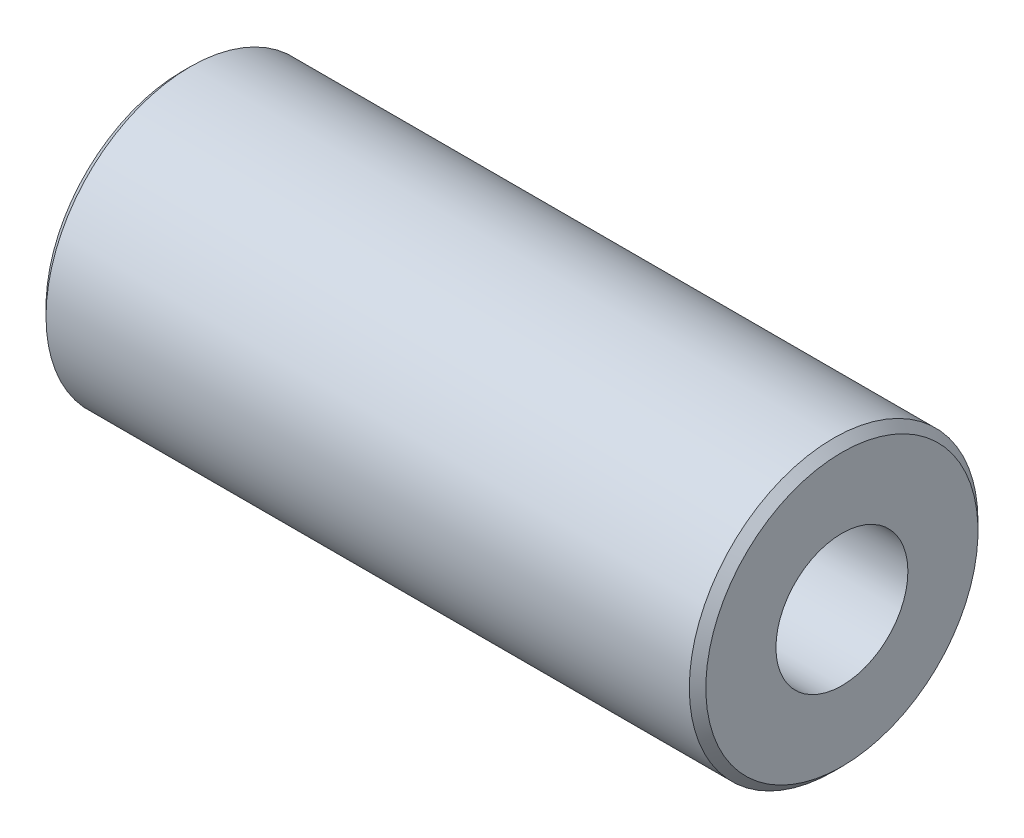
from build123d import *

# Parameters (mm, degrees)
SKETCH_1_W     = 8
SKETCH_1_H     = 1.75
CHAMFER_1_SIZE = 0.1


with BuildPart() as part:
    # 草图1 → 旋转1 (revolve)
    with BuildSketch(Plane.XY, mode=Mode.PRIVATE) as revolve_1_sk:
        with Locations((0, 0.875)):
            Rectangle(SKETCH_1_W, SKETCH_1_H)
    revolve(revolve_1_sk.sketch.rotate(Axis((-4, 0, 0), (1, 0, 0)), 180), axis=Axis((-4, 0, 0), (1, 0, 0)))

    # 草图3 → Hole Wizard 378 (revolve, cut)
    with BuildSketch(Plane(origin=(-4, 0, 0), x_dir=(0, 0, 1), z_dir=(0, 1, 0))):
        Polygon((0, 0), (0, 6.480688495), (0.8, 6), (0.8, 0), align=None)
    hole_wizard_378 = revolve(axis=Axis((-10.35, 0, 0), (1, 0, 0)), mode=Mode.SUBTRACT)

    # 镜向1: Hole Wizard 378 across plane
    add(hole_wizard_378.mirror(Plane(origin=(0, 0, 0), x_dir=(0, 0, 1), z_dir=(1, 0, 0))), mode=Mode.SUBTRACT)

    # 倒角1
    chamfer_1_edges = [part.edges().sort_by_distance(p)[0] for p in [
        (-4, 1.75, 0),
        (4, 1.75, 0),
    ]]
    chamfer(chamfer_1_edges, length=CHAMFER_1_SIZE)


solid = part.part
